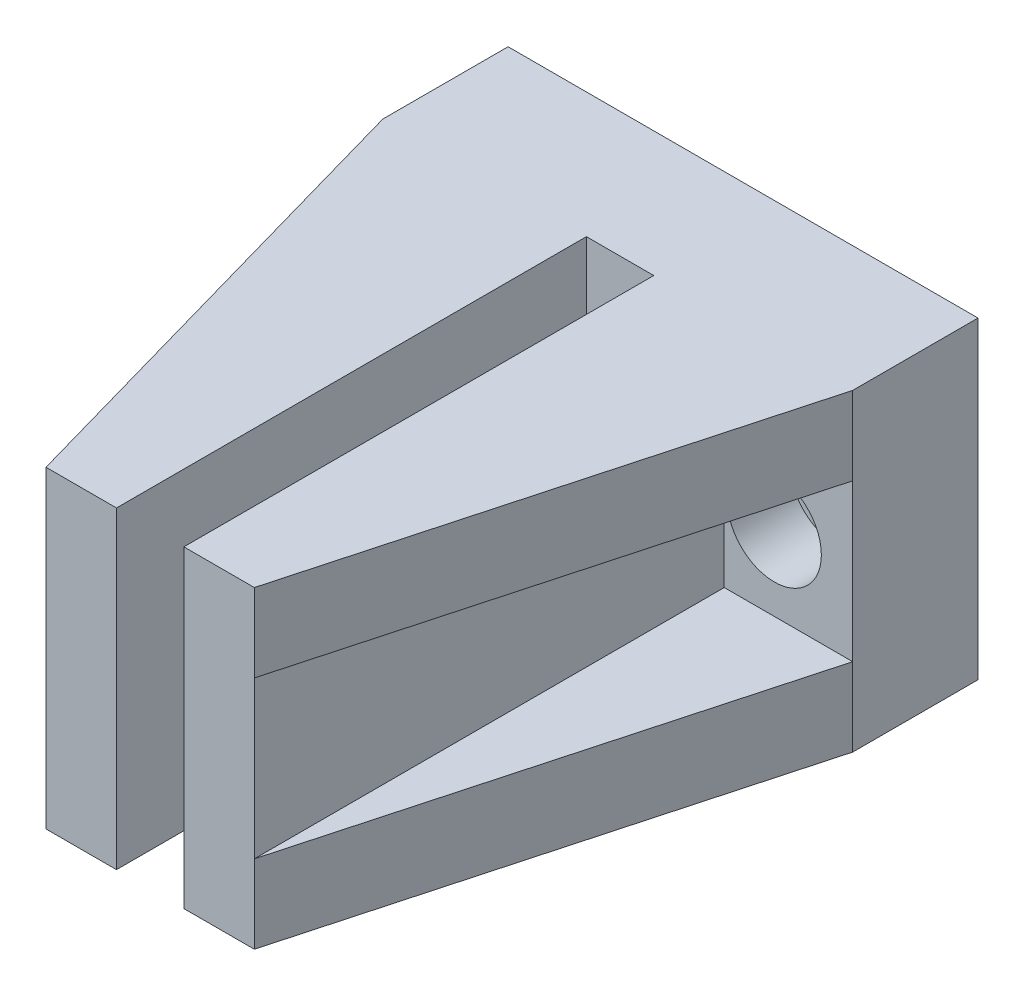
from build123d import *

# Parameters (mm, degrees)
SKETCH1_W           = 30
SKETCH1_H           = 20
SKETCH1_R           = 1.65
BOSS_EXTRUDE1_DEPTH = 8
SKETCH3_W           = 4.5
SKETCH3_H           = 20
BOSS_EXTRUDE2_DEPTH = 30
BOSS_EXTRUDE3_DEPTH = 20
SKETCH6_W           = 8.5
SKETCH6_H           = 10
SKETCH6_W_2         = 8.2
CUT_EXTRUDE2_DEPTH  = 30
SKETCH10_R          = 3
CUT_EXTRUDE5_DEPTH  = 4


with BuildPart() as part:
    # Sketch1 → Boss-Extrude1 (new body)
    with BuildSketch(Plane.XY):
        Rectangle(SKETCH1_W, SKETCH1_H)
        with Locations((-10, 0)):
            Circle(SKETCH1_R, mode=Mode.SUBTRACT)
        with Locations((9.999778189, -0.094193404)):
            Circle(SKETCH1_R, mode=Mode.SUBTRACT)
    extrude(amount=BOSS_EXTRUDE1_DEPTH)

    # Sketch3 → Boss-Extrude2 (add)
    with BuildSketch(Plane.XY.offset(8)):
        with Locations((-4.25, 0)):
            Rectangle(SKETCH3_W, SKETCH3_H)
        with Locations((4.55, 0)):
            Rectangle(SKETCH3_W, SKETCH3_H)
    extrude(amount=BOSS_EXTRUDE2_DEPTH)

    # Sketch5 → Boss-Extrude3 (add)
    with BuildSketch(Plane(origin=(0, 10, 0), x_dir=(1, 0, 0), z_dir=(0, 1, 0))):
        Polygon((-15, -8), (-6.5, -38), (-6.5, -8), align=None)
        Polygon((15, -8), (6.8, -8), (6.8, -38), align=None)
    extrude(amount=-BOSS_EXTRUDE3_DEPTH)

    # Sketch6 → Cut-Extrude2 (cut)
    with BuildSketch(Plane.XY.offset(38)):
        with Locations((-10.75, 0)):
            Rectangle(SKETCH6_W, SKETCH6_H)
        with Locations((10.9, 0)):
            Rectangle(SKETCH6_W_2, SKETCH6_H)
    extrude(amount=-CUT_EXTRUDE2_DEPTH, mode=Mode.SUBTRACT)

    # Sketch10 → Cut-Extrude5 (cut)
    with BuildSketch(Plane.XY.offset(8)):
        with Locations((-10, 0)):
            Circle(SKETCH10_R)
        with Locations((9.999778189, -0.094193404)):
            Circle(SKETCH10_R)
    extrude(amount=-CUT_EXTRUDE5_DEPTH, mode=Mode.SUBTRACT)


solid = part.part
